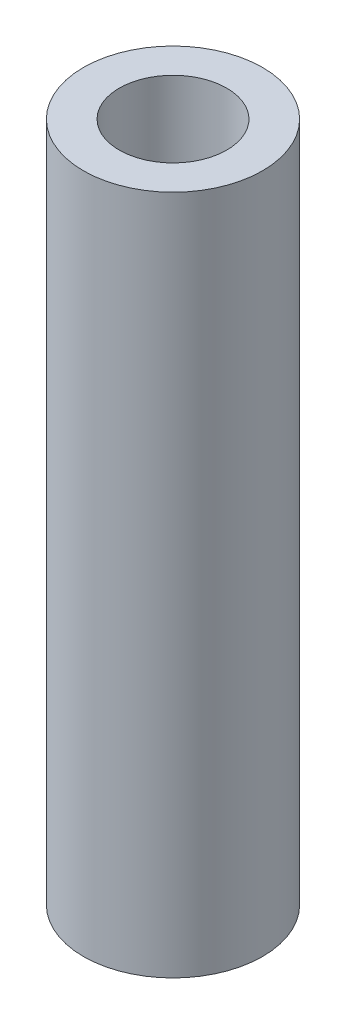
from build123d import *

# Parameters (mm, degrees)
SKETCH1_R           = 6.35
SKETCH1_R_2         = 3.81
BOSS_EXTRUDE1_DEPTH = 48.26


with BuildPart() as part:
    # Sketch1 → Boss-Extrude1 (new body)
    with BuildSketch(Plane(origin=(0, 0, 0), x_dir=(1, 0, 0), z_dir=(0, 1, 0))):
        with Locations(Location((0, 0, 0), (0, 0, 90))):
            Circle(SKETCH1_R)
        with Locations(Location((0, 0, 0), (0, 0, 90))):
            Circle(SKETCH1_R_2, mode=Mode.SUBTRACT)
    extrude(amount=BOSS_EXTRUDE1_DEPTH)


solid = part.part
